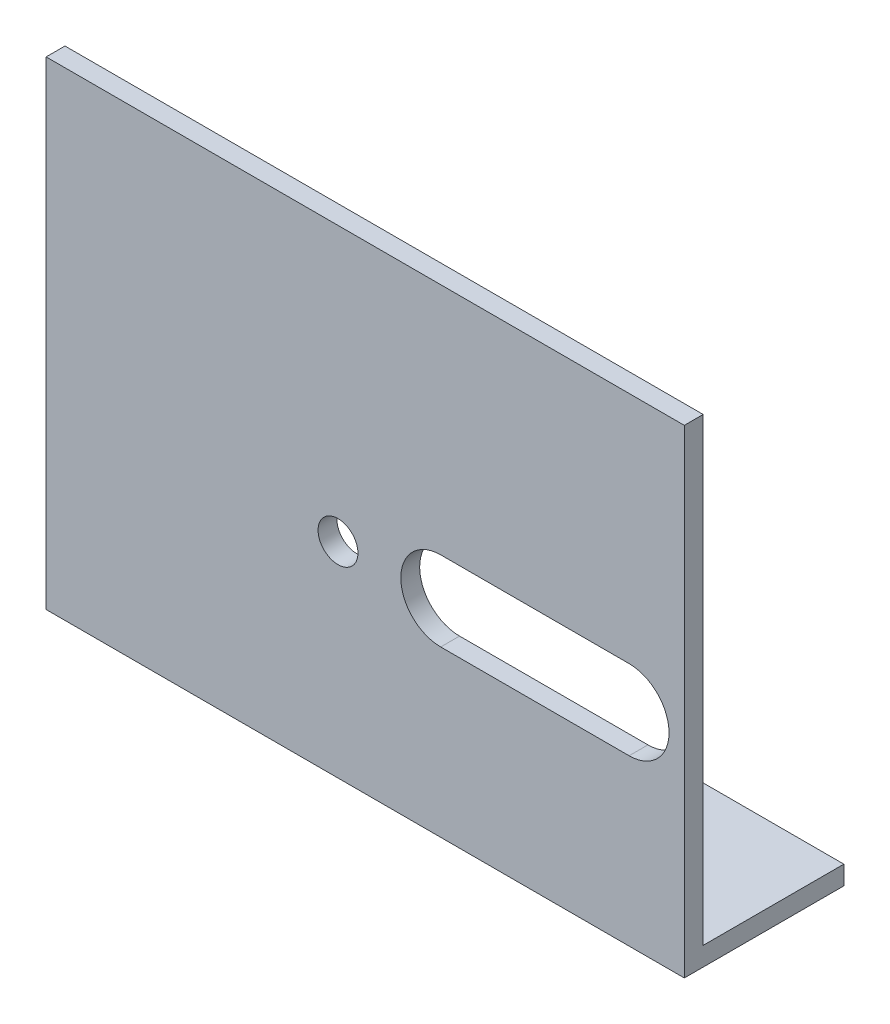
from build123d import *

# Parameters (mm, degrees)
SALIENTE_EXTRUIR1_DEPTH = 50.8
CROQUIS2_R              = 3.175
CORTAR_EXTRUIR1_DEPTH   = 96.038097624


with BuildPart() as part:
    # Croquis1 → Saliente-Extruir1 (new, symmetric)
    with BuildSketch(Plane(origin=(0, 0, 0), x_dir=(0, 0, -1), z_dir=(1, 0, 0))):
        Polygon((0, 76.2), (0, 0), (25.4, 0), (25.4, 3), (3, 3), (3, 76.2), align=None)
    extrude(amount=SALIENTE_EXTRUIR1_DEPTH, both=True)

    # Croquis2 → Cortar-Extruir1 (cut, through all)
    with BuildSketch(Plane.XY):
        with Locations((-4.334249313, 32.6)):
            Circle(CROQUIS2_R)
        with BuildLine():
            Line((42.015750687, 26.25), (12.015750687, 26.25))
            ThreePointArc((12.015750687, 26.25), (5.665750687, 32.6), (12.015750687, 38.95))
            Line((12.015750687, 38.95), (42.015750687, 38.95))
            ThreePointArc((42.015750687, 38.95), (48.365750687, 32.6), (42.015750687, 26.25))
        make_face()
    extrude(amount=-CORTAR_EXTRUIR1_DEPTH, mode=Mode.SUBTRACT)


solid = part.part
